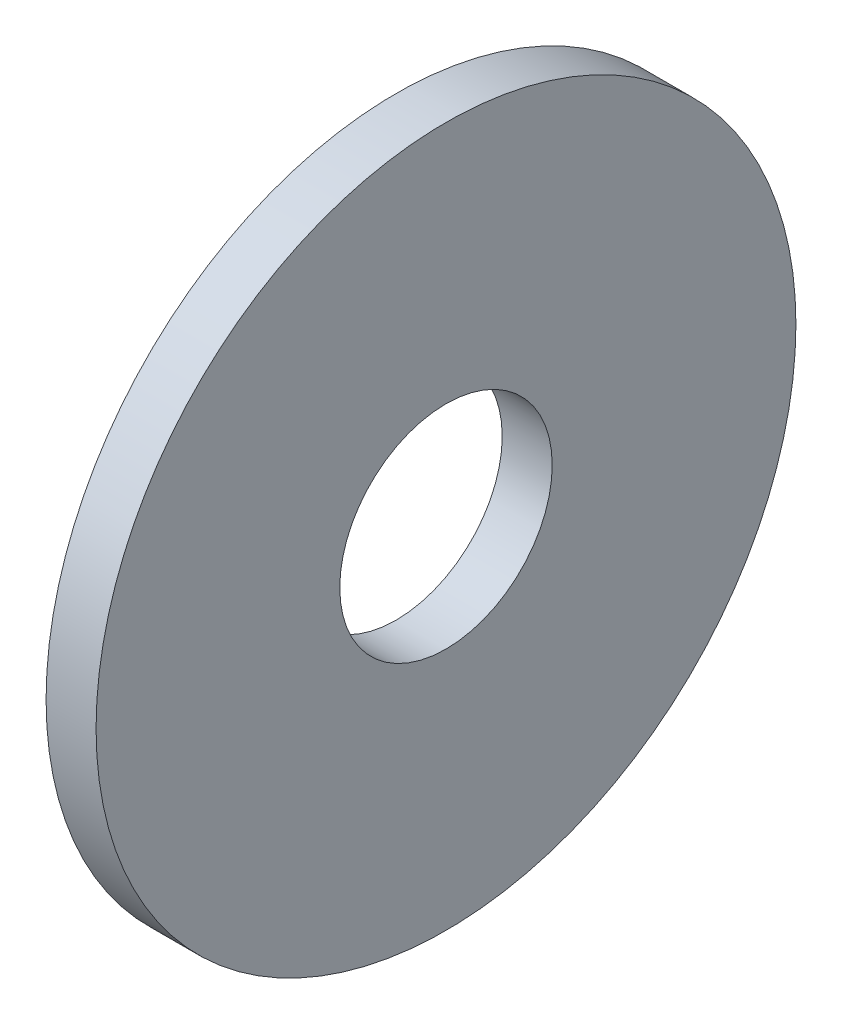
from build123d import *

# Parameters (mm, degrees)
SKETCH1_R           = 14
SKETCH1_R_2         = 4.25
BOSS_EXTRUDE1_DEPTH = 1


with BuildPart() as part:
    # Sketch1 → Boss-Extrude1 (new, symmetric)
    with BuildSketch(Plane(origin=(0, 0, 0), x_dir=(0, 0, -1), z_dir=(1, 0, 0))):
        Circle(SKETCH1_R)
        Circle(SKETCH1_R_2, mode=Mode.SUBTRACT)
    extrude(amount=BOSS_EXTRUDE1_DEPTH, both=True)


solid = part.part
